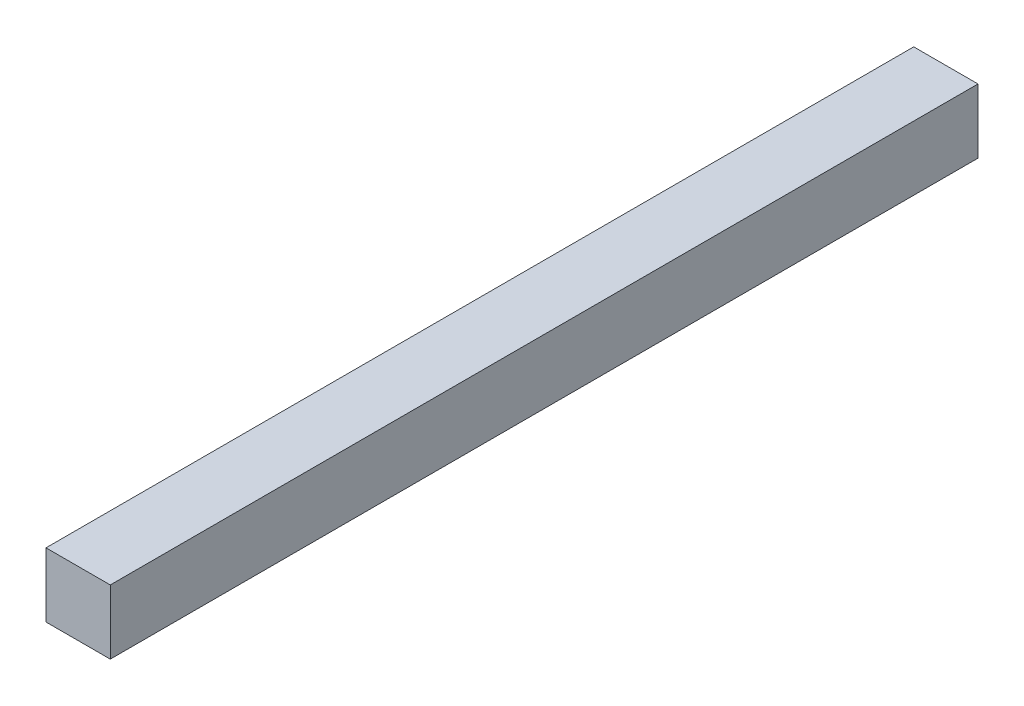
from build123d import *

# Parameters (mm, degrees)
SKETCH1_W           = 2.54
SKETCH1_H           = 2.54
BOSS_EXTRUDE1_DEPTH = 34.29


with BuildPart() as part:
    # Sketch1 → Boss-Extrude1 (new body)
    with BuildSketch(Plane.XY):
        with Locations((-1.27, 1.27)):
            Rectangle(SKETCH1_W, SKETCH1_H)
    extrude(amount=BOSS_EXTRUDE1_DEPTH)


solid = part.part
